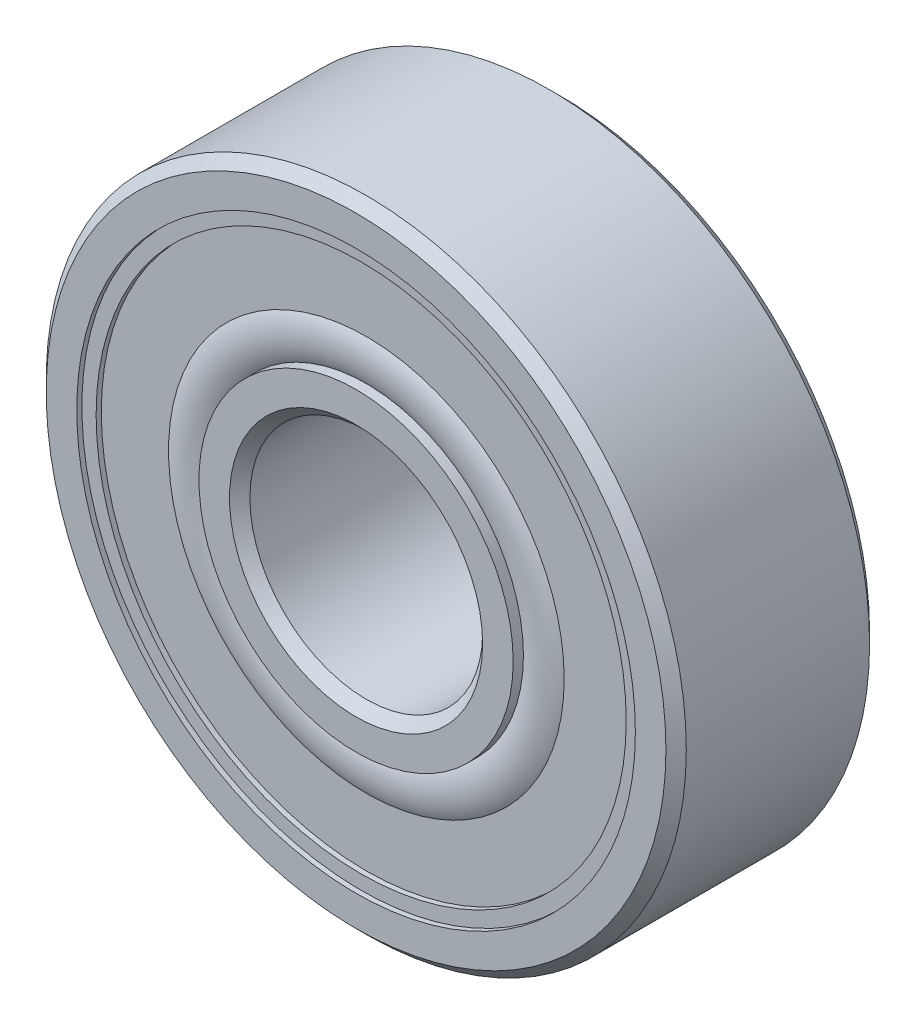
from build123d import *

# Parameters (mm, degrees)
CIRPATTERN1_COUNT = 7


with BuildPart() as part:
    # Sketch3 → Revolve1 (revolve)
    with BuildSketch(Plane(origin=(0, 0, 0), x_dir=(0, 0, -1), z_dir=(1, 0, 0)), mode=Mode.PRIVATE) as revolve1_sk:
        with BuildLine():
            Line((-3.5, 10.65), (-3.5, 9.6))
            Line((-3.5, 9.6), (-1.555555556, 9.6))
            ThreePointArc((-1.555555556, 9.6), (0, 10.113379629), (1.555555556, 9.6))
            Line((1.555555556, 9.6), (3.5, 9.6))
            Line((3.5, 9.6), (3.5, 10.65))
            Line((3.5, 10.65), (3.15, 11))
            Line((3.15, 11), (-3.15, 11))
            Line((-3.15, 11), (-3.5, 10.65))
        make_face()
        with BuildLine():
            Line((-3.5, 4.35), (-3.5, 5.4))
            Line((-3.5, 5.4), (-1.555555556, 5.4))
            ThreePointArc((-1.555555556, 5.4), (0, 4.886620371), (1.555555556, 5.4))
            Line((1.555555556, 5.4), (3.5, 5.4))
            Line((3.5, 5.4), (3.5, 4.35))
            Line((3.5, 4.35), (3.15, 4))
            Line((3.15, 4), (-3.15, 4))
            Line((-3.15, 4), (-3.5, 4.35))
        make_face()
    revolve(revolve1_sk.sketch.rotate(Axis((0, 0, 3.5), (0, 0, -1)), 90), axis=Axis((0, 0, 3.5), (0, 0, -1)))


with BuildPart() as body_2:
    # Sketch4 → Revolve2 (revolve)
    with BuildSketch(Plane(origin=(0, 0, 0), x_dir=(0, 0, -1), z_dir=(1, 0, 0))):
        with BuildLine():
            Line((-2.613379629, 7.5), (2.613379629, 7.5))
            ThreePointArc((2.613379629, 7.5), (0, 10.113379629), (-2.613379629, 7.5))
        make_face()
    revolve(axis=Axis((0, 7.5, 2.613379629), (0, 0, -1)))


with BuildPart() as cirpattern1_1:
    # CirPattern1: pattern copy
    add(body_2.part.rotate(Axis((0, 0, 0), (0, 0, 1)), 1 * 360 / CIRPATTERN1_COUNT))


with BuildPart() as cirpattern1_2:
    # CirPattern1: pattern copy
    add(body_2.part.rotate(Axis((0, 0, 0), (0, 0, 1)), 2 * 360 / CIRPATTERN1_COUNT))


with BuildPart() as cirpattern1_3:
    # CirPattern1: pattern copy
    add(body_2.part.rotate(Axis((0, 0, 0), (0, 0, 1)), 3 * 360 / CIRPATTERN1_COUNT))


with BuildPart() as cirpattern1_4:
    # CirPattern1: pattern copy
    add(body_2.part.rotate(Axis((0, 0, 0), (0, 0, 1)), 4 * 360 / CIRPATTERN1_COUNT))


with BuildPart() as cirpattern1_5:
    # CirPattern1: pattern copy
    add(body_2.part.rotate(Axis((0, 0, 0), (0, 0, 1)), 5 * 360 / CIRPATTERN1_COUNT))


with BuildPart() as cirpattern1_6:
    # CirPattern1: pattern copy
    add(body_2.part.rotate(Axis((0, 0, 0), (0, 0, 1)), 6 * 360 / CIRPATTERN1_COUNT))


with BuildPart() as body_9:
    # Sketch5 → Revolve3 (revolve)
    with BuildSketch(Plane(origin=(0, 0, 0), x_dir=(0, 0, -1), z_dir=(1, 0, 0)), mode=Mode.PRIVATE) as revolve3_sk:
        with BuildLine():
            Line((-3.325, 9.6), (-2.613379629, 9.6))
            Line((-2.613379629, 9.6), (-2.613379629, 5.4))
            Line((-2.613379629, 5.4), (-3.147094907, 5.4))
            ThreePointArc((-3.147094907, 5.4), (-3.325, 6.1), (-3.147094907, 6.8))
            Line((-3.147094907, 6.8), (-3.147094907, 9.11))
            Line((-3.147094907, 9.11), (-3.325, 9.11))
            Line((-3.325, 9.11), (-3.325, 9.6))
        make_face()
        with BuildLine():
            Line((3.147094907, 5.4), (2.613379629, 5.4))
            Line((2.613379629, 5.4), (2.613379629, 9.6))
            Line((2.613379629, 9.6), (3.325, 9.6))
            Line((3.325, 9.6), (3.325, 9.11))
            Line((3.325, 9.11), (3.147094907, 9.11))
            Line((3.147094907, 9.11), (3.147094907, 6.8))
            ThreePointArc((3.147094907, 6.8), (3.325, 6.1), (3.147094907, 5.4))
        make_face()
    revolve(revolve3_sk.sketch.rotate(Axis((0, 0, 3.5), (0, 0, -1)), 90), axis=Axis((0, 0, 3.5), (0, 0, -1)))


solid = Compound([part.part, body_2.part, cirpattern1_1.part, cirpattern1_2.part, cirpattern1_3.part, cirpattern1_4.part, cirpattern1_5.part, cirpattern1_6.part, body_9.part])
